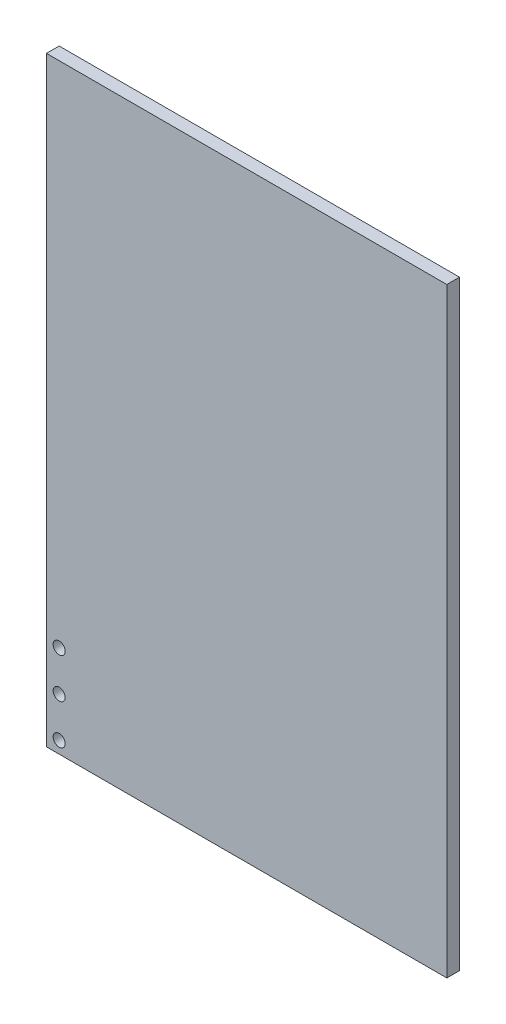
from build123d import *

# Parameters (mm, degrees)
SKETCH1_W           = 100
SKETCH1_H           = 3.175
BOSS_EXTRUDE1_DEPTH = 150
SKETCH2_R           = 1.5
CUT_EXTRUDE2_DEPTH  = 3.175
SKETCH3_R           = 1.5
CUT_EXTRUDE3_DEPTH  = 3.175


with BuildPart() as part:
    # Sketch1 → Boss-Extrude1 (new body)
    with BuildSketch(Plane(origin=(0, 0, 0), x_dir=(1, 0, 0), z_dir=(0, 1, 0))):
        with Locations((50, 1.5875)):
            Rectangle(SKETCH1_W, SKETCH1_H)
    extrude(amount=BOSS_EXTRUDE1_DEPTH)

    # Sketch2 → Cut-Extrude2 (cut)
    with BuildSketch(Plane.XY):
        with Locations((3.175, 3)):
            Circle(SKETCH2_R)
        with Locations((3.175, 13)):
            Circle(SKETCH2_R)
    extrude(amount=-CUT_EXTRUDE2_DEPTH, mode=Mode.SUBTRACT)

    # Sketch3 → Cut-Extrude3 (cut)
    with BuildSketch(Plane.XY):
        with Locations((3.175, 23)):
            Circle(SKETCH3_R)
    extrude(amount=-CUT_EXTRUDE3_DEPTH, mode=Mode.SUBTRACT)


solid = part.part
